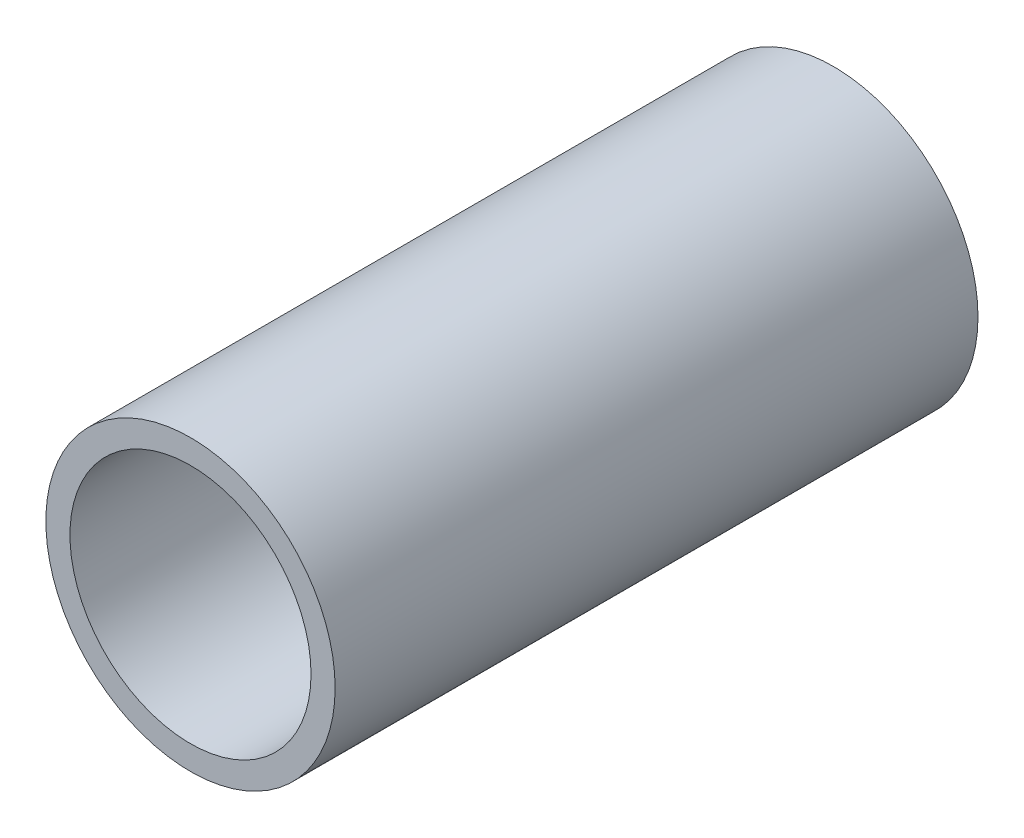
from build123d import *

# Parameters (mm, degrees)
SKETCH1_R           = 9
SKETCH1_R_2         = 7.5
BOSS_EXTRUDE1_DEPTH = 40


with BuildPart() as part:
    # Sketch1 → Boss-Extrude1 (new body)
    with BuildSketch(Plane.XY):
        Circle(SKETCH1_R)
        Circle(SKETCH1_R_2, mode=Mode.SUBTRACT)
    extrude(amount=BOSS_EXTRUDE1_DEPTH)


solid = part.part
